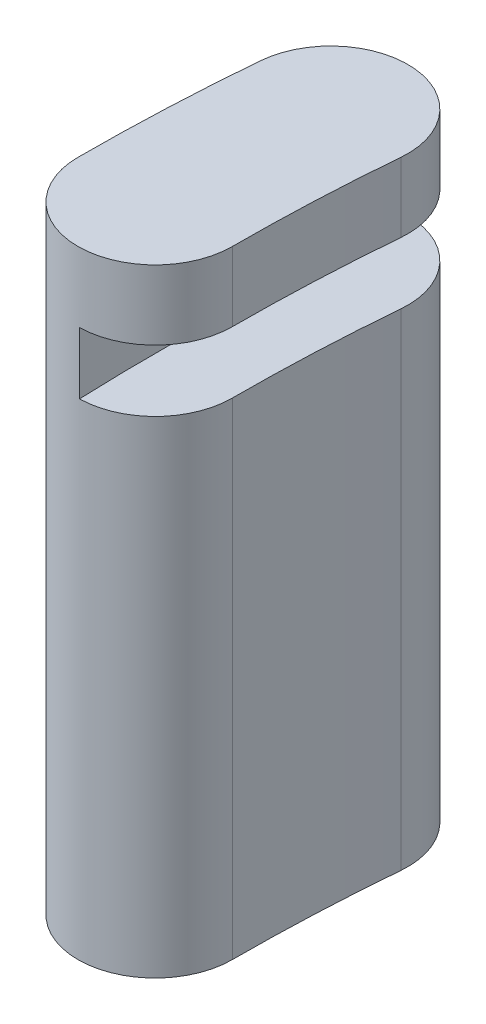
from build123d import *

# Parameters (mm, degrees)
BOSS_EXTRUDE1_DEPTH = 40
CUT_EXTRUDE4_DEPTH  = 4


with BuildPart() as part:
    # Sketch1 → Boss-Extrude1 (new body)
    with BuildSketch(Plane(origin=(0, 0, 0), x_dir=(1, 0, 0), z_dir=(0, 1, 0))):
        with BuildLine():
            ThreePointArc((-129.505310752, 11.330246557), (-129.876268806, 5.670520357), (-130, 0))
            ThreePointArc((-130, 0), (-125, -5), (-120, 0))
            ThreePointArc((-120, 0), (-119.88578659, 5.234326484), (-119.543363771, 10.45868913))
            ThreePointArc((-119.543363771, 10.45868913), (-124.088558548, 15.875441334), (-129.505310752, 11.330246557))
        make_face()
    extrude(amount=BOSS_EXTRUDE1_DEPTH)

    # Sketch2 → Cut-Extrude4 (cut)
    with BuildSketch(Plane(origin=(0, 31.5, 0), x_dir=(1, 0, 0), z_dir=(0, 1, 0))):
        with BuildLine():
            ThreePointArc((-123.989026242, 15.865729465), (-124.881027698, 5.452423421), (-124.9, -4.9989999))
            ThreePointArc((-124.9, -4.9989999), (-121.429285786, -3.5), (-120, 0))
            ThreePointArc((-120, 0), (-119.88578659, 5.234326484), (-119.543363771, 10.45868913))
            ThreePointArc((-119.543363771, 10.45868913), (-120.662165593, 14.069941037), (-123.989026242, 15.865729465))
        make_face()
    extrude(amount=CUT_EXTRUDE4_DEPTH, mode=Mode.SUBTRACT)


solid = part.part
